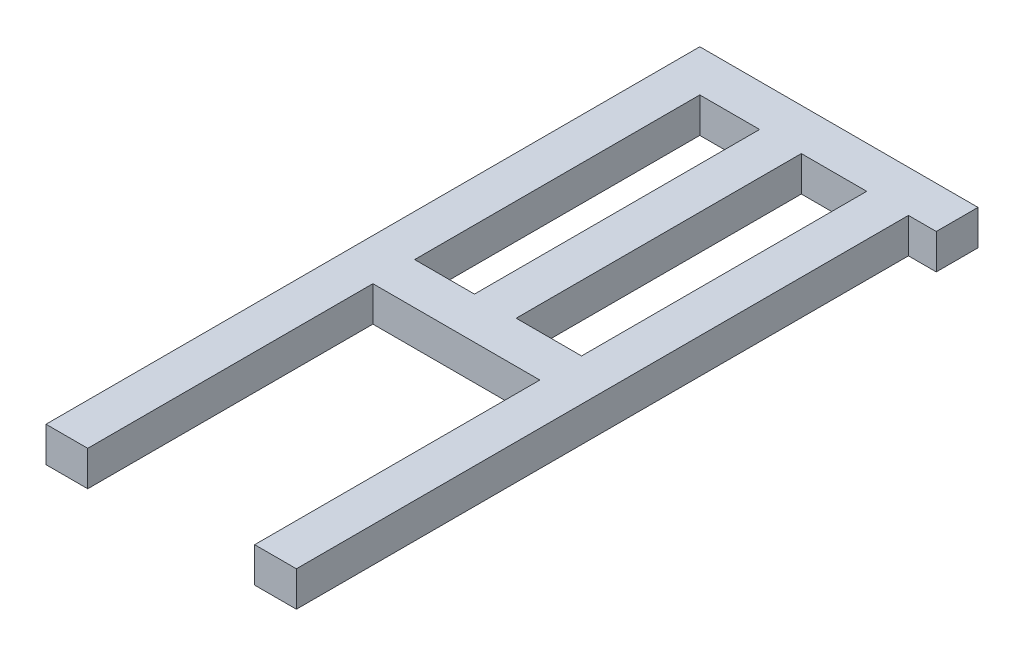
from build123d import *

# Parameters (mm, degrees)
ESQUISSE1_W                = 75
ESQUISSE1_H                = 63
BOSS_EXTRU_1_DEPTH         = 1100
R_P_TITION_LIN_AIRE2_COUNT = 2
R_P_TITION_LIN_AIRE2_PITCH = 375
ESQUISSE3_W                = 75
ESQUISSE3_H                = 63
BOSS_EXTRU_2_DEPTH         = 512.5
BOSS_EXTRU_3_DEPTH         = 182.5
BOSS_EXTRU_3_DEPTH_BACK    = 192.5
ESQUISSE4_W                = 75
ESQUISSE4_H                = 63
ESQUISSE5_W                = 75
ESQUISSE5_H                = 63
BOSS_EXTRU_4_DEPTH         = 500


with BuildPart() as part:
    # Esquisse1 → Boss.-Extru.1 (new body)
    with BuildSketch(Plane.XY):
        with Locations((37.5, 31.5)):
            Rectangle(ESQUISSE1_W, ESQUISSE1_H)
    extrude(amount=BOSS_EXTRU_1_DEPTH)


with BuildPart() as r_p_tition_lin_aire2_1:
    # Répétition linéaire2: pattern copy
    add(part.part.moved(Location(Vector(-1, 0, 0) * (1 * R_P_TITION_LIN_AIRE2_PITCH))))


with BuildPart() as body_3:
    # Esquisse3 → Boss.-Extru.2 (new body)
    with BuildSketch(Plane.XY):
        with Locations((-155, 31.5)):
            Rectangle(ESQUISSE3_W, ESQUISSE3_H)
    extrude(amount=BOSS_EXTRU_2_DEPTH)


with BuildPart() as part_1:
    add(part.part)

    add(r_p_tition_lin_aire2_1.part)  # Boss.-Extru.3 merges Répétition linéaire2_1

    add(body_3.part)  # Boss.-Extru.3 merges body 3
    # Esquisse4 → Boss.-Extru.3 (add, two sides: drawn at the far end of the back side and taken through both)
    with BuildSketch(Plane.ZY.offset(192.5).offset(-BOSS_EXTRU_3_DEPTH_BACK)):
        with Locations((550, 31.5)):
            Rectangle(ESQUISSE4_W, ESQUISSE4_H)
    extrude(amount=BOSS_EXTRU_3_DEPTH + BOSS_EXTRU_3_DEPTH_BACK)

    # Esquisse5 → Boss.-Extru.4 (add)
    with BuildSketch(Plane.ZY.offset(375)):
        with Locations((-37.5, 31.5)):
            Rectangle(ESQUISSE5_W, ESQUISSE5_H)
    extrude(amount=-BOSS_EXTRU_4_DEPTH)


solid = part_1.part
